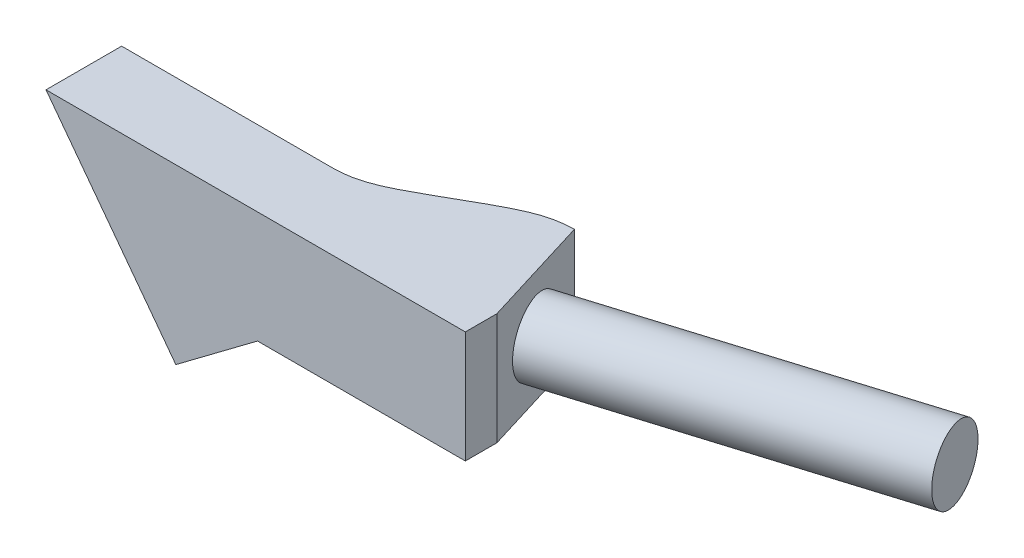
from build123d import *

# Parameters (mm, degrees)
BOSS_EXTRUDE1_DEPTH      = 12.7
BOSS_EXTRUDE1_DEPTH_BACK = 12.7
SKETCH1_W                = 76.2
SKETCH1_H                = 25.4
CUT_EXTRUDE1_DEPTH       = 48.519048812
SKETCH4_R                = 7.9375
BOSS_EXTRUDE2_DEPTH      = 76.2
BOSS_EXTRUDE3_DEPTH      = 10
BOSS_EXTRUDE5_DEPTH      = 7.178167


with BuildPart() as part:
    # Sketch1 → Boss-Extrude1 (new, two sides: drawn at the far end of the back side and taken through both)
    with BuildSketch(Plane.XY.offset(-BOSS_EXTRUDE1_DEPTH_BACK)):
        Rectangle(SKETCH1_W, SKETCH1_H)
    extrude(amount=BOSS_EXTRUDE1_DEPTH + BOSS_EXTRUDE1_DEPTH_BACK)

    # Sketch2 → Cut-Extrude1 (cut, through all)
    with BuildSketch(Plane.XZ.offset(12.7)):
        Polygon((34.199985956, 0), (30.299971912, -12.7), (38.1, -12.7), (38.1, -1.197646421), align=None)
        Polygon((38.1, 12.7), (34.199985956, 0), (38.1, -1.197646421), align=None)
        with BuildLine():
            Line((30.299971912, -12.7), (-38.1, -12.7))
            Line((-38.1, -12.7), (-38.1, 2.7))
            Line((-38.1, 2.7), (-9.105646135, 2.7))
            add(Edge.make_bspline(
                [(30.299971912, -12.7), (25.466803171, -12.7), (16.707798139, -8.78817181), (4.449206283, -1.21182819), (-4.185142014, 2.7), (-9.105646135, 2.7)],
                knots=[0, 0, 0, 0, 0.311689084, 0.688310916, 1, 1, 1, 1], degree=3))
        make_face()
    extrude(amount=-CUT_EXTRUDE1_DEPTH, mode=Mode.SUBTRACT)

    # Sketch4 → Boss-Extrude2 (add)
    with BuildSketch(Plane(origin=(31.252760971, 0, -9.59733911), x_dir=(-0.2935578385035089, 0, -0.95594131381228), z_dir=(0.95594131381228, 0, -0.2935578385035089))):
        with Locations((-10.039678032, 0)):
            Circle(SKETCH4_R)
    extrude(amount=BOSS_EXTRUDE2_DEPTH)

    # Sketch5 → Boss-Extrude3 (add)
    with BuildSketch(Plane(origin=(0, 0, 2.7), x_dir=(-1, 0, 0), z_dir=(0, 0, -1))):
        Polygon((9.105646135, -12.7), (27.661608652, -26.617413502), (38.1, -12.7), align=None)
        Polygon((38.1, -12.7), (57.150604496, 12.7), (38.1, 12.7), align=None)
    extrude(amount=-BOSS_EXTRUDE3_DEPTH)

    # Sketch7 → Boss-Extrude5 (add)
    with BuildSketch(Plane.XY.offset(12.7)):
        Polygon((-57.150604496, 12.7), (-27.661608652, -26.617413502), (-9.105646135, -12.7), (38.1, -12.7), (38.1, 12.7), align=None)
    extrude(amount=BOSS_EXTRUDE5_DEPTH)


solid = part.part
